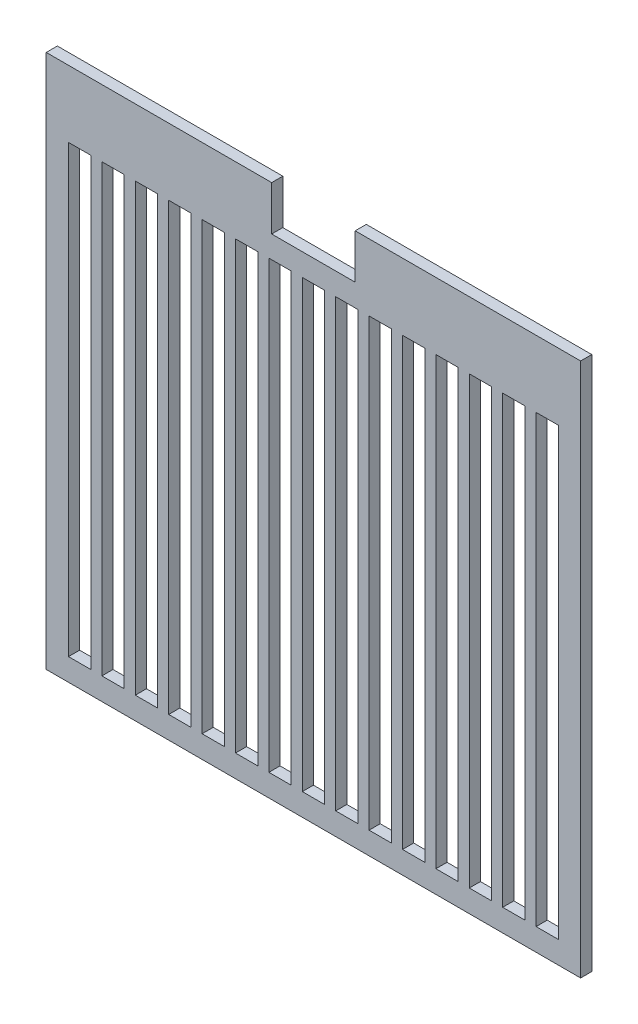
from build123d import *

# Parameters (mm, degrees)
SKETCH1_W             = 96
SKETCH1_H             = 96
BOSS_EXTRUDE2_DEPTH   = 2
FINGER_OPENING_HOLE_W = 15
FINGER_OPENING_HOLE_H = 8
OPENING_HOLE_DEPTH    = 2
AIRFLOW_W             = 4
AIRFLOW_H             = 80
AIR_FLOW_DEPTH        = 2


with BuildPart() as part:
    # Sketch1 → Boss-Extrude2 (new body)
    with BuildSketch(Plane.XY):
        with Locations((48, 48)):
            Rectangle(SKETCH1_W, SKETCH1_H)
    extrude(amount=BOSS_EXTRUDE2_DEPTH)

    # Finger Opening Hole → Opening Hole (cut)
    with BuildSketch(Plane.XY.offset(2)):
        with Locations((48, 92)):
            Rectangle(FINGER_OPENING_HOLE_W, FINGER_OPENING_HOLE_H)
    extrude(amount=-OPENING_HOLE_DEPTH, mode=Mode.SUBTRACT)

    # Airflow → Air Flow (cut)
    with BuildSketch(Plane.XY.offset(2)):
        with Locations((12, 44)):
            Rectangle(AIRFLOW_W, AIRFLOW_H)
        with Locations((6, 44)):
            Rectangle(AIRFLOW_W, AIRFLOW_H)
        with Locations((18, 44)):
            Rectangle(AIRFLOW_W, AIRFLOW_H)
        with Locations((24, 44)):
            Rectangle(AIRFLOW_W, AIRFLOW_H)
        with Locations((30, 44)):
            Rectangle(AIRFLOW_W, AIRFLOW_H)
        with Locations((36, 44)):
            Rectangle(AIRFLOW_W, AIRFLOW_H)
        with Locations((42, 44)):
            Rectangle(AIRFLOW_W, AIRFLOW_H)
        with Locations((48, 44)):
            Rectangle(AIRFLOW_W, AIRFLOW_H)
        with Locations((54, 44)):
            Rectangle(AIRFLOW_W, AIRFLOW_H)
        with Locations((60, 44)):
            Rectangle(AIRFLOW_W, AIRFLOW_H)
        with Locations((66, 44)):
            Rectangle(AIRFLOW_W, AIRFLOW_H)
        with Locations((72, 44)):
            Rectangle(AIRFLOW_W, AIRFLOW_H)
        with Locations((78, 44)):
            Rectangle(AIRFLOW_W, AIRFLOW_H)
        with Locations((84, 44)):
            Rectangle(AIRFLOW_W, AIRFLOW_H)
        with Locations((90, 44)):
            Rectangle(AIRFLOW_W, AIRFLOW_H)
    extrude(amount=-AIR_FLOW_DEPTH, mode=Mode.SUBTRACT)


solid = part.part
